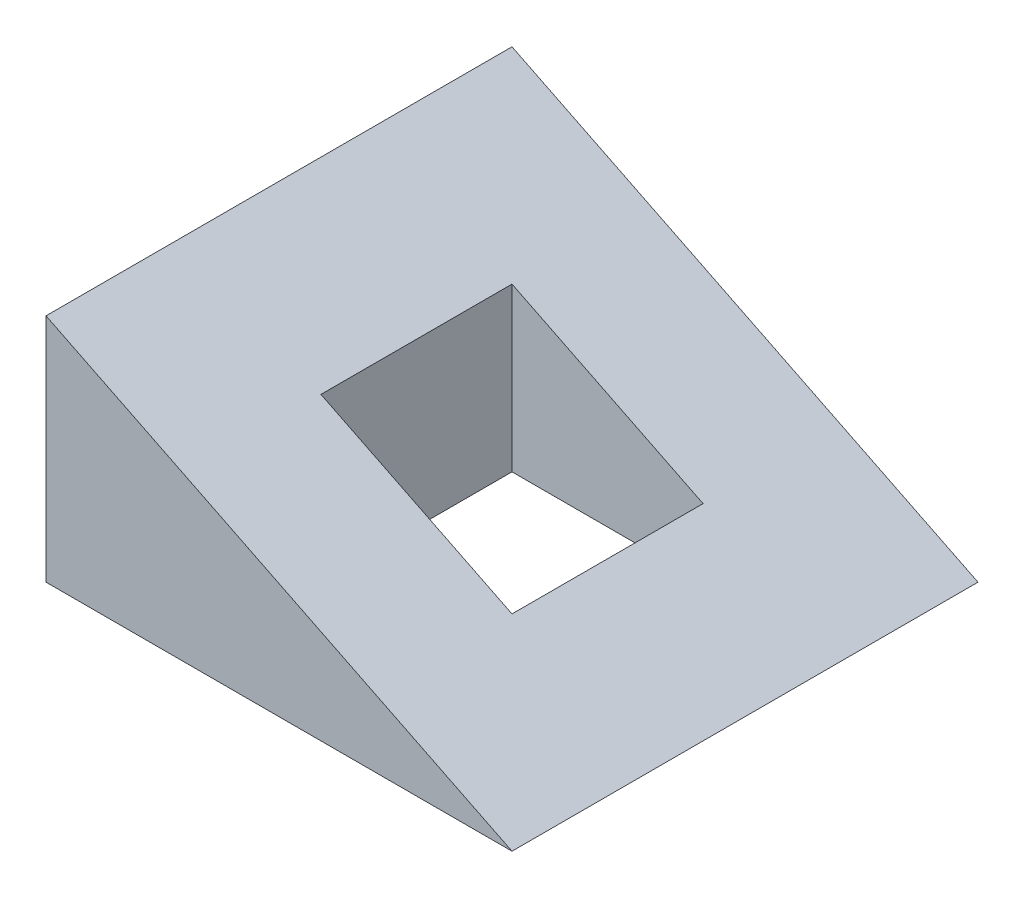
from build123d import *

# Parameters (mm, degrees)
SALIENTE_EXTRUIR1_DEPTH = 20
CROQUIS2_W              = 8.2
CROQUIS2_H              = 8.2
CORTAR_EXTRUIR1_DEPTH   = 20


with BuildPart() as part:
    # Croquis1 → Saliente-Extruir1 (new body)
    with BuildSketch(Plane.XY):
        Polygon((0, 0), (20, 0), (0, 9.9), align=None)
    extrude(amount=SALIENTE_EXTRUIR1_DEPTH)

    # Croquis2 → Cortar-Extruir1 (cut)
    with BuildSketch(Plane.XZ):
        with Locations((10, 10)):
            Rectangle(CROQUIS2_W, CROQUIS2_H)
    extrude(amount=-CORTAR_EXTRUIR1_DEPTH, mode=Mode.SUBTRACT)


solid = part.part
